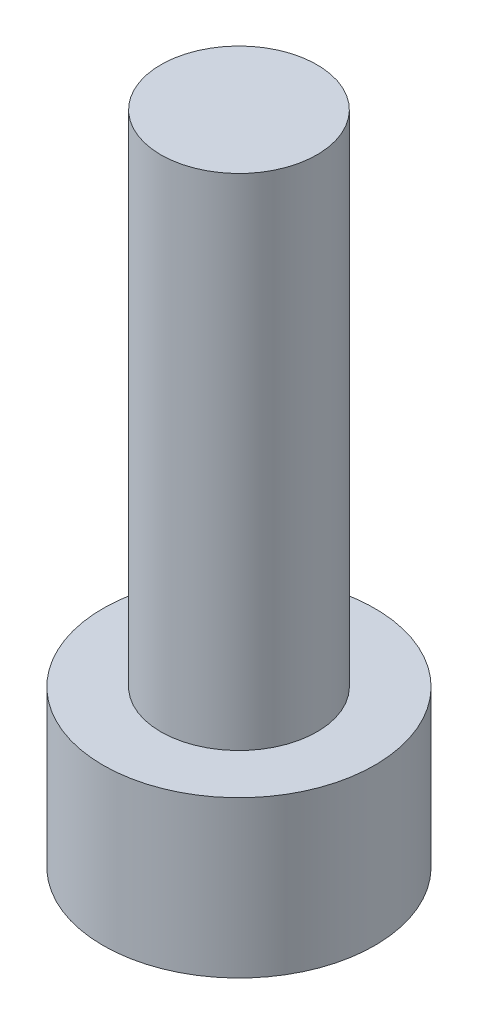
from build123d import *

# Parameters (mm, degrees)
SKETCH_1_R          = 4.35
EXTRUDE_1_DEPTH     = 5
SKETCH_2_R          = 2.5
EXTRUDE_2_DEPTH     = 16
CUT_EXTRUDE_1_DEPTH = 2.5


with BuildPart() as part:
    # 草图1 → 凸台-拉伸1 (new body)
    with BuildSketch(Plane(origin=(0, 0, 0), x_dir=(1, 0, 0), z_dir=(0, 1, 0))):
        with Locations(Location((0, 0, 0), (0, 0, 270))):
            Circle(SKETCH_1_R)
    extrude(amount=EXTRUDE_1_DEPTH)

    # 草图2 → 凸台-拉伸2 (add)
    with BuildSketch(Plane(origin=(0, 5, 0), x_dir=(1, 0, 0), z_dir=(0, 1, 0))):
        with Locations(Location((0, 0, 0), (0, 0, 270))):
            Circle(SKETCH_2_R)
    extrude(amount=EXTRUDE_2_DEPTH)

    # 草图3 → 切除-拉伸1 (cut)
    with BuildSketch(Plane.XZ):
        Polygon((1.546358871, -1.715257291), (2.258635824, 0.48155742), (0.712276953, 2.196814711), (-1.546358871, 1.715257291), (-2.258635824, -0.48155742), (-0.712276953, -2.196814711), align=None)
    extrude(amount=-CUT_EXTRUDE_1_DEPTH, mode=Mode.SUBTRACT)


solid = part.part
